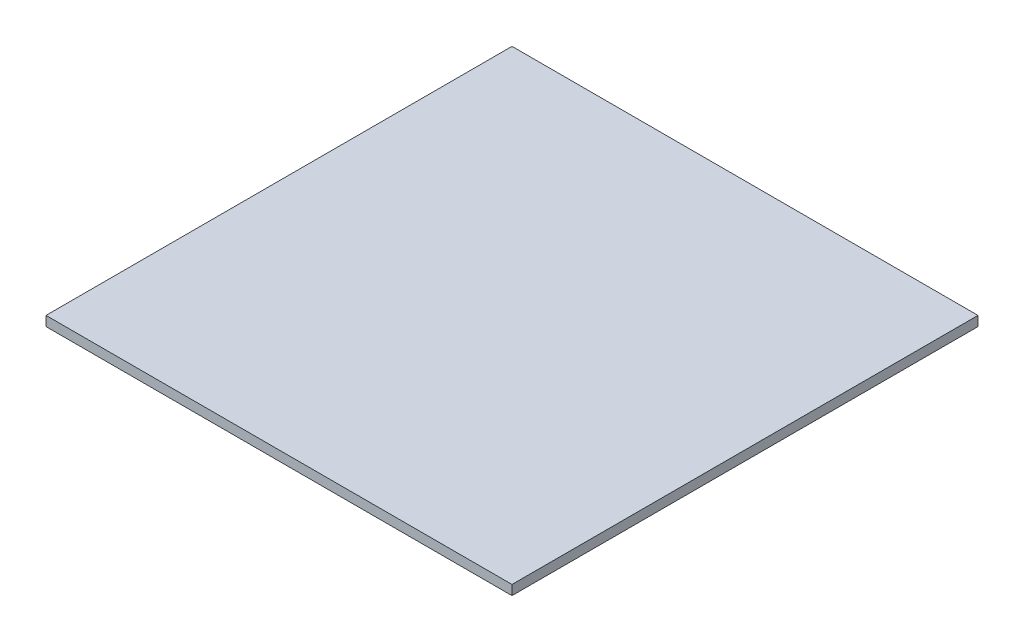
from build123d import *

# Parameters (mm, degrees)
SKETCH1_W           = 1219.2
SKETCH1_H           = 1219.2
BOSS_EXTRUDE1_DEPTH = 25.4


with BuildPart() as part:
    # Sketch1 → Boss-Extrude1 (new body)
    with BuildSketch(Plane(origin=(0, 0, 0), x_dir=(1, 0, 0), z_dir=(0, 1, 0))):
        Rectangle(SKETCH1_W, SKETCH1_H)
    extrude(amount=-BOSS_EXTRUDE1_DEPTH)


solid = part.part
